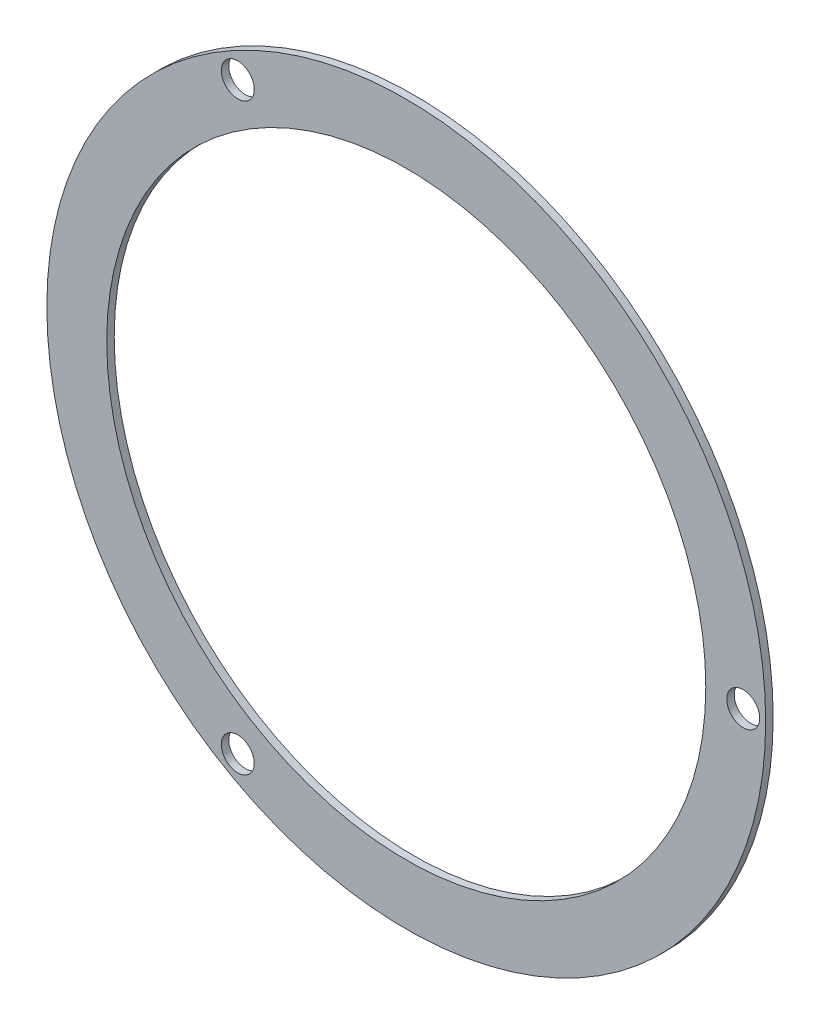
from build123d import *

# Parameters (mm, degrees)
SKETCH1_R                 = 24
SKETCH1_R_2               = 20
BOSS_EXTRUDE1_DEPTH       = 0.5
SKETCH2_R                 = 1.1
RETAINER_THREE_D2P2_DEPTH = 0.51


with BuildPart() as part:
    # Sketch1 → Boss-Extrude1 (new body)
    with BuildSketch(Plane.XY):
        Circle(SKETCH1_R)
        Circle(SKETCH1_R_2, mode=Mode.SUBTRACT)
    extrude(amount=BOSS_EXTRUDE1_DEPTH)

    # Sketch2 → Retainer_Three_D2p2 (cut)
    with BuildSketch(Plane(origin=(0, 0, 0), x_dir=(-1, 0, 0), z_dir=(0, 0, -1))):
        with Locations((-22.5, 0)):
            Circle(SKETCH2_R)
        with Locations((11.25, 19.485571585)):
            Circle(SKETCH2_R)
        with Locations((11.25, -19.485571585)):
            Circle(SKETCH2_R)
    extrude(amount=-RETAINER_THREE_D2P2_DEPTH, mode=Mode.SUBTRACT)


solid = part.part
